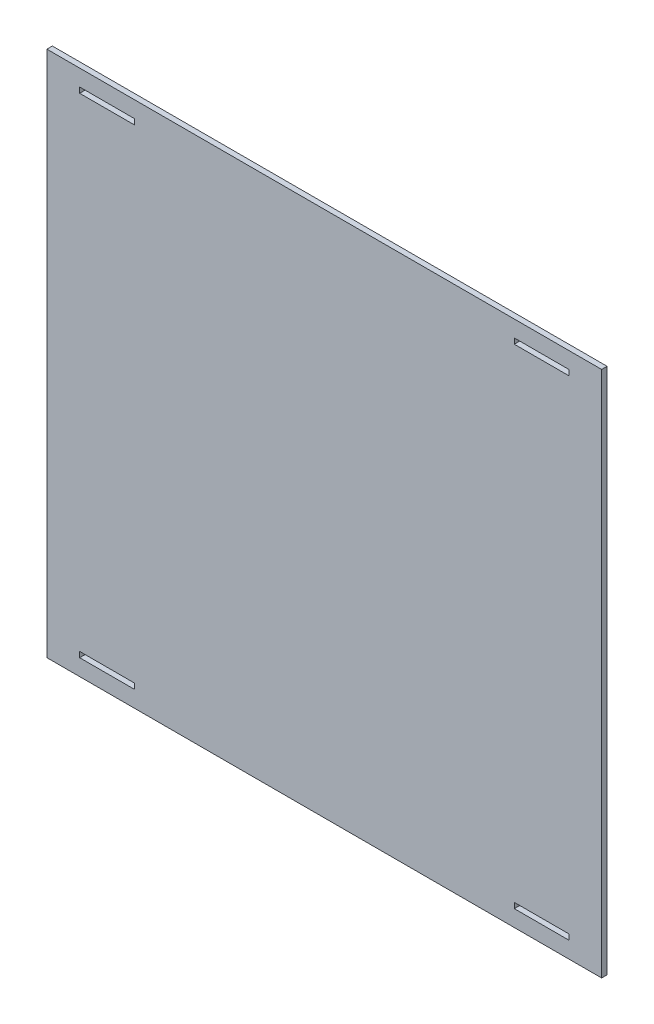
from build123d import *

# Parameters (mm, degrees)
SKETCH1_W           = 508
SKETCH1_H           = 482.6
BOSS_EXTRUDE1_DEPTH = 5
SKETCH2_W           = 50
SKETCH2_H           = 5
CUT_EXTRUDE1_DEPTH  = 5


with BuildPart() as part:
    # Sketch1 → Boss-Extrude1 (new body)
    with BuildSketch(Plane.XY):
        with Locations((-254, 241.3)):
            Rectangle(SKETCH1_W, SKETCH1_H)
    extrude(amount=BOSS_EXTRUDE1_DEPTH)

    # Sketch2 → Cut-Extrude1 (cut)
    with BuildSketch(Plane.XY.offset(5)):
        with Locations((-453, 465.1)):
            Rectangle(SKETCH2_W, SKETCH2_H)
        with Locations((-55, 465.1)):
            Rectangle(SKETCH2_W, SKETCH2_H)
        with Locations((-55, 17.5)):
            Rectangle(SKETCH2_W, SKETCH2_H)
        with Locations((-453, 17.5)):
            Rectangle(SKETCH2_W, SKETCH2_H)
    extrude(amount=-CUT_EXTRUDE1_DEPTH, mode=Mode.SUBTRACT)


solid = part.part
